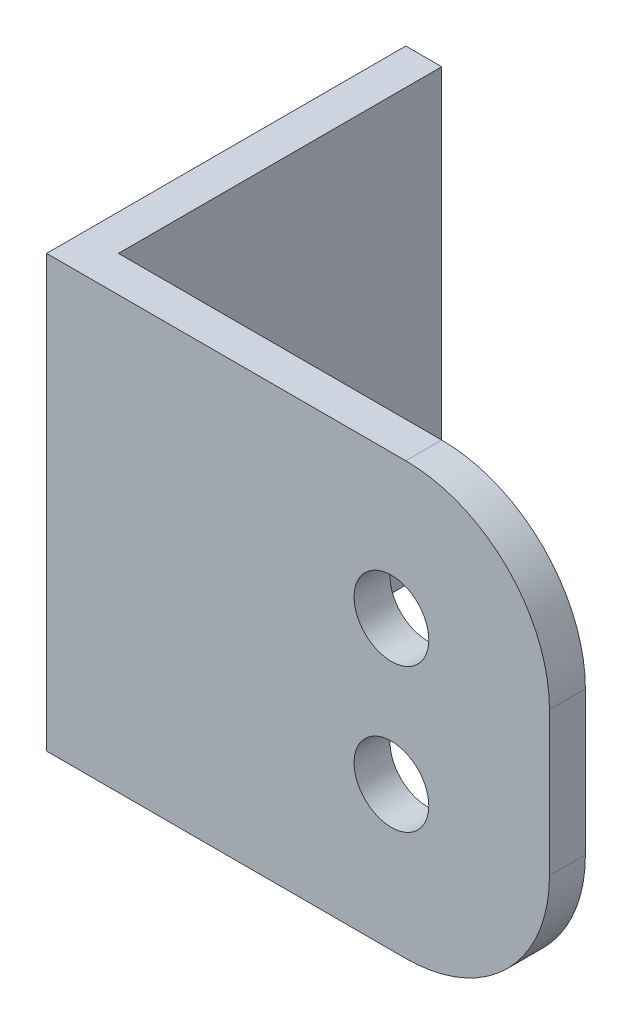
from build123d import *

# Parameters (mm, degrees)
SKETCH1_W               = 44.45
SKETCH1_H               = 38.1
BOSS_EXTRUDE1_DEPTH     = 3.175
CUT_EXTRUDE1_DEPTH      = 49.464271634
CUT_EXTRUDE1_DEPTH_BACK = 49.464271634
SKETCH2_R               = 3.302
SKETCH3_W               = 3.175
SKETCH3_H               = 38.1
BOSS_EXTRUDE2_DEPTH     = 28.575
FILLET1_R               = 12.7


with BuildPart() as part:
    # Sketch1 → Boss-Extrude1 (new body)
    with BuildSketch(Plane.XY):
        with Locations((22.225, 0)):
            Rectangle(SKETCH1_W, SKETCH1_H)
    extrude(amount=BOSS_EXTRUDE1_DEPTH)

    # Sketch2 → Cut-Extrude1 (cut, two sides: drawn at the far end of the back side and taken through both)
    with BuildSketch(Plane.XY.offset(3.175).offset(-CUT_EXTRUDE1_DEPTH_BACK)):
        with Locations((30.48, 6.35)):
            Circle(SKETCH2_R)
        with Locations((30.48, -6.35)):
            Circle(SKETCH2_R)
    extrude(amount=CUT_EXTRUDE1_DEPTH + CUT_EXTRUDE1_DEPTH_BACK, mode=Mode.SUBTRACT)

    # Sketch3 → Boss-Extrude2 (add)
    with BuildSketch(Plane(origin=(0, 0, 0), x_dir=(-1, 0, 0), z_dir=(0, 0, -1))):
        with Locations((-1.5875, 0)):
            Rectangle(SKETCH3_W, SKETCH3_H)
    extrude(amount=BOSS_EXTRUDE2_DEPTH)

    # Fillet1
    fillet1_edges = [part.edges().sort_by_distance(p)[0] for p in [
        (44.45, 19.05, 1.5875),
        (44.45, -19.05, 1.5875),
    ]]
    fillet(fillet1_edges, radius=FILLET1_R)


solid = part.part
